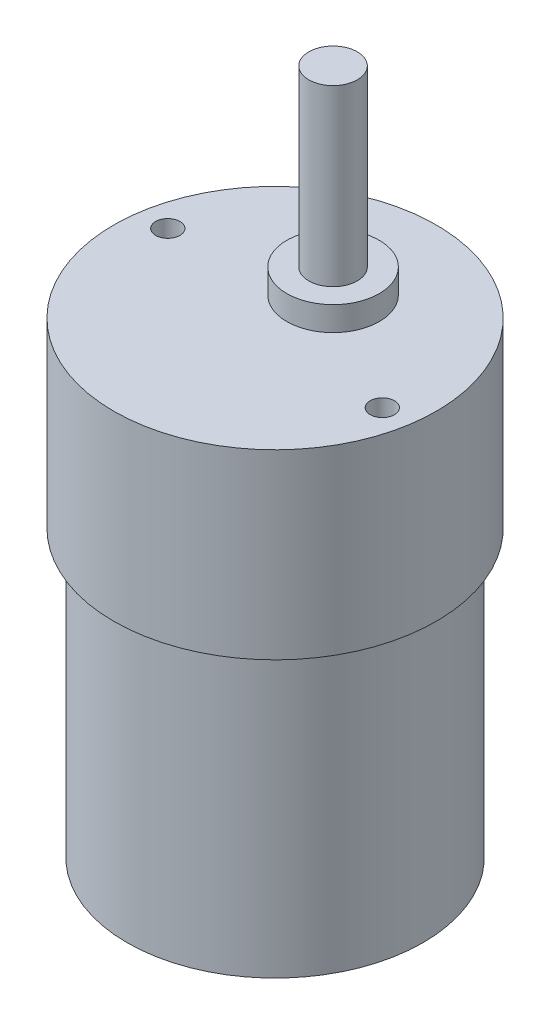
from build123d import *

# Parameters (mm, degrees)
SKETCH1_R           = 13.3
BOSS_EXTRUDE1_DEPTH = 15
SKETCH2_R           = 12.2
BOSS_EXTRUDE2_DEPTH = 23.5
SKETCH3_R           = 3.81
BOSS_EXTRUDE4_DEPTH = 2
CUT_EXTRUDE2_START  = -4
SKETCH3_6_R         = 1
SKETCH3_6_R_2       = 3.81
CUT_EXTRUDE2_DEPTH  = 4
SKETCH7_R           = 2
BOSS_EXTRUDE5_DEPTH = 14.36


with BuildPart() as part:
    # Sketch1 → Boss-Extrude1 (new body)
    with BuildSketch(Plane(origin=(0, 0, 0), x_dir=(1, 0, 0), z_dir=(0, 1, 0))):
        Circle(SKETCH1_R)
    extrude(amount=BOSS_EXTRUDE1_DEPTH)

    # Sketch2 → Boss-Extrude2 (add)
    with BuildSketch(Plane.XZ):
        Circle(SKETCH2_R)
    extrude(amount=BOSS_EXTRUDE2_DEPTH)

    # Sketch3 → Boss-Extrude4 (add)
    with BuildSketch(Plane(origin=(0, 15, 0), x_dir=(1, 0, 0), z_dir=(0, 1, 0))):
        with Locations((0.738912194, 4.043032126)):
            Circle(SKETCH3_R)
    extrude(amount=BOSS_EXTRUDE4_DEPTH)

    # Sketch3<6> → Cut-Extrude2 (cut)
    with BuildSketch(Plane(origin=(0, 15, 0), x_dir=(1, 0, 0), z_dir=(0, 1, 0)).offset(CUT_EXTRUDE2_START)):
        with Locations((10.820767246, -1.977623877)):
            Circle(SKETCH3_6_R)
        with Locations((-10.820767246, 1.977623877)):
            Circle(SKETCH3_6_R)
        with Locations((0.738912194, 4.043032126)):
            Circle(SKETCH3_6_R_2)
    extrude(amount=CUT_EXTRUDE2_DEPTH, mode=Mode.SUBTRACT)


with BuildPart() as cut_extrude2_piece_1:
    # of the separate pieces the step leaves, piece 1, a body of its own (cut_extrude2_pieces)
    add(part.part.solids().sort_by_distance((13.3, 0, 0))[0])


with BuildPart() as cut_extrude2_piece_2:
    # of the separate pieces the step leaves, piece 2, a body of its own (cut_extrude2_pieces)
    add(part.part.solids().sort_by_distance((4.548912194, 17, -4.043032126))[0])

    # Sketch7 → Boss-Extrude5 (add)
    with BuildSketch(Plane(origin=(0, 17, 0), x_dir=(1, 0, 0), z_dir=(0, 1, 0))):
        with Locations((0.738912194, 4.043032126)):
            Circle(SKETCH7_R)
    extrude(amount=BOSS_EXTRUDE5_DEPTH)


solid = Compound([cut_extrude2_piece_1.part, cut_extrude2_piece_2.part])
